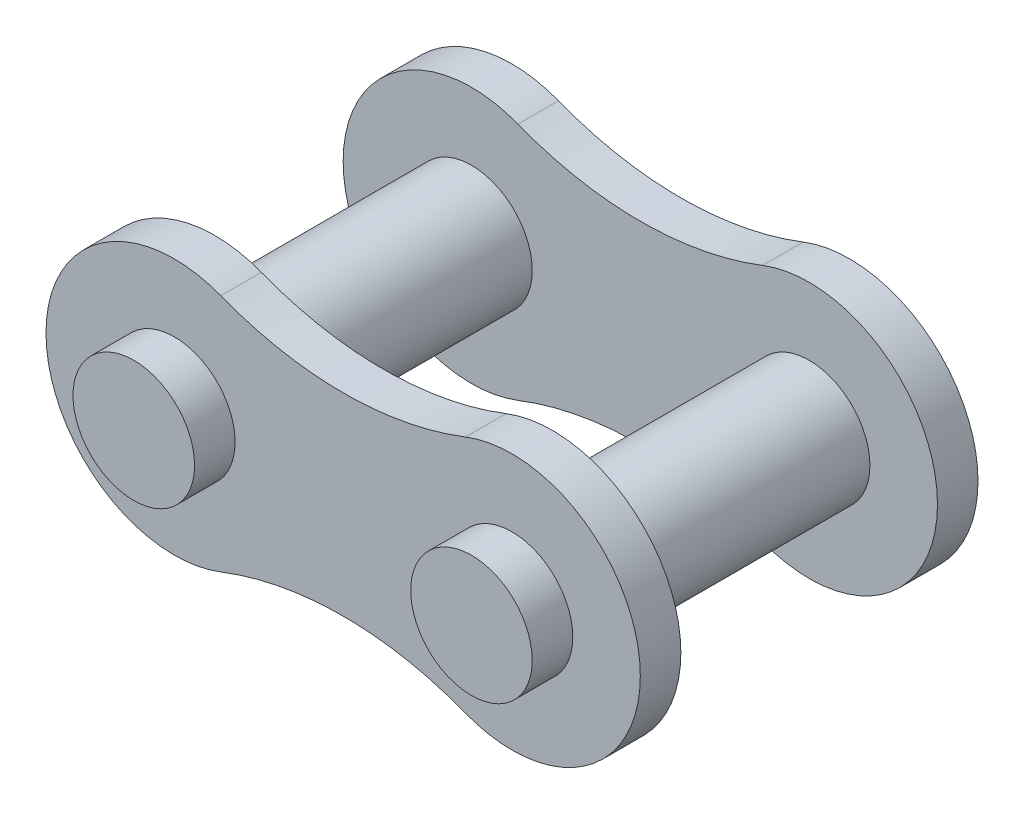
from build123d import *

# Parameters (mm, degrees)
OUTER_START        = 3.175
SKETCH4_R          = 1.143
OUTER_LINK_1_DEPTH = 0.762
SKETCH5_R          = 1.143
PINS_DEPTH         = 3.937


with BuildPart() as part:
    # Sketch4 → outer link 1 (new body)
    with BuildSketch(Plane.XY.offset(OUTER_START)):
        with BuildLine():
            ThreePointArc((-7.224275362, -2.249046818), (-3.937, 0), (-7.224275362, 2.249046818))
            ThreePointArc((-7.224275362, 2.249046818), (-9.525, 1.817591077), (-11.825724638, 2.249046818))
            ThreePointArc((-11.825724638, 2.249046818), (-15.113, 0), (-11.825724638, -2.249046818))
            ThreePointArc((-11.825724638, -2.249046818), (-9.525, -1.817591077), (-7.224275362, -2.249046818))
        make_face()
        with Locations((-12.7, 0)):
            Circle(SKETCH4_R, mode=Mode.SUBTRACT)
        with Locations((-6.35, 0)):
            Circle(SKETCH4_R, mode=Mode.SUBTRACT)
    extrude(amount=-OUTER_LINK_1_DEPTH)


with BuildPart() as body_2:
    # outer link 2: mirrored copy
    add(part.part.mirror(Plane.XY))


with BuildPart() as part_1:
    add(part.part)

    add(body_2.part)  # pins merges body 2
    # Sketch5 → pins (add, symmetric)
    with BuildSketch(Plane.XY):
        with Locations((-12.7, 0)):
            Circle(SKETCH5_R)
        with Locations((-6.35, 0)):
            Circle(SKETCH5_R)
    extrude(amount=PINS_DEPTH, both=True)


solid = part_1.part
